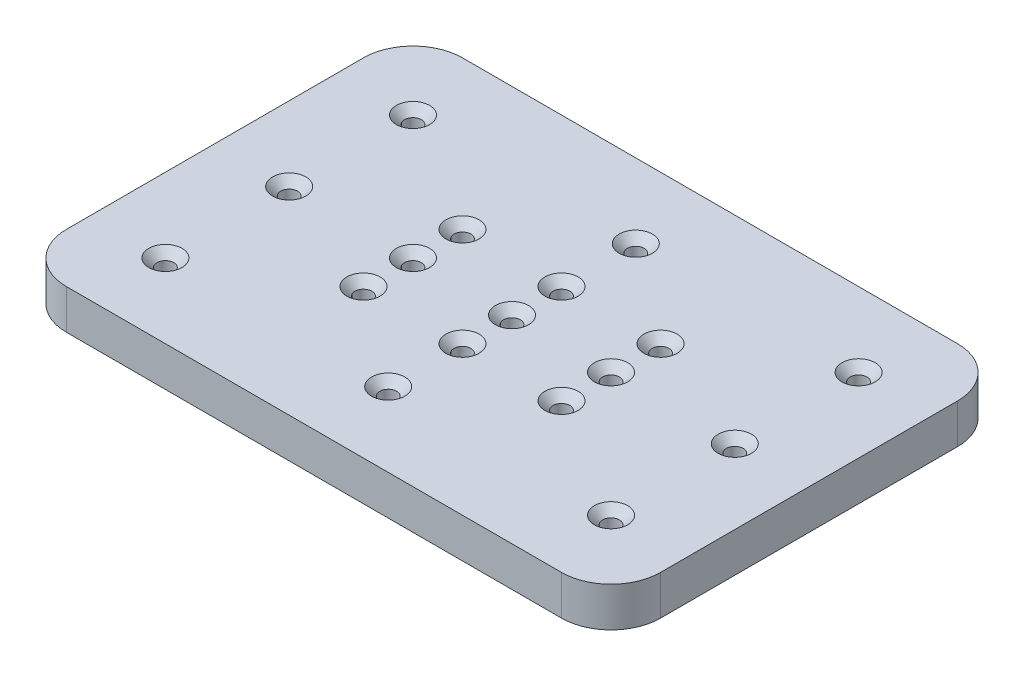
from build123d import *

# Parameters (mm, degrees)
BOSS_EXTRUDE2_DEPTH                                  = 8
CSK_FOR_M3_HEX_SOCKET_COUNTERSUNK_CAP_SC_D           = 3.4
CSK_FOR_M3_HEX_SOCKET_COUNTERSUNK_CAP_SC_CSINK_D     = 6.72
CSK_FOR_M3_HEX_SOCKET_COUNTERSUNK_CAP_SC_CSINK_ANGLE = 90


with BuildPart() as part:
    # Sketch3 → Boss-Extrude2 (new body)
    with BuildSketch(Plane(origin=(0, 0, 0), x_dir=(1, 0, 0), z_dir=(0, 1, 0))):
        with BuildLine():
            Line((-50, 40), (50, 40))
            ThreePointArc((50, 40), (57.071067812, 37.071067812), (60, 30))
            Line((60, 30), (60, -30))
            ThreePointArc((60, -30), (57.071067812, -37.071067812), (50, -40))
            Line((50, -40), (-50, -40))
            ThreePointArc((-50, -40), (-57.071067812, -37.071067812), (-60, -30))
            Line((-60, -30), (-60, 30))
            ThreePointArc((-60, 30), (-57.071067812, 37.071067812), (-50, 40))
        make_face()
    extrude(amount=BOSS_EXTRUDE2_DEPTH)

    # CSK for M3 Hex Socket Countersunk Cap Screw1 (through all)
    with Locations(Plane(origin=(0, 8, 0), x_dir=(1, 0, 0), z_dir=(0, 1, 0))):
        with Locations((0, 0), (0, 10), (0, 25), (20, 10), (20, 0), (45, 0), (45, 25), (-45, 25), (-45, 0), (-20, 10), (-20, 0), (-20, -10), (-45, -25), (45, -25), (20, -10), (0, -25), (0, -10)):
            CounterSinkHole(CSK_FOR_M3_HEX_SOCKET_COUNTERSUNK_CAP_SC_D / 2, CSK_FOR_M3_HEX_SOCKET_COUNTERSUNK_CAP_SC_CSINK_D / 2, counter_sink_angle=CSK_FOR_M3_HEX_SOCKET_COUNTERSUNK_CAP_SC_CSINK_ANGLE)


solid = part.part
